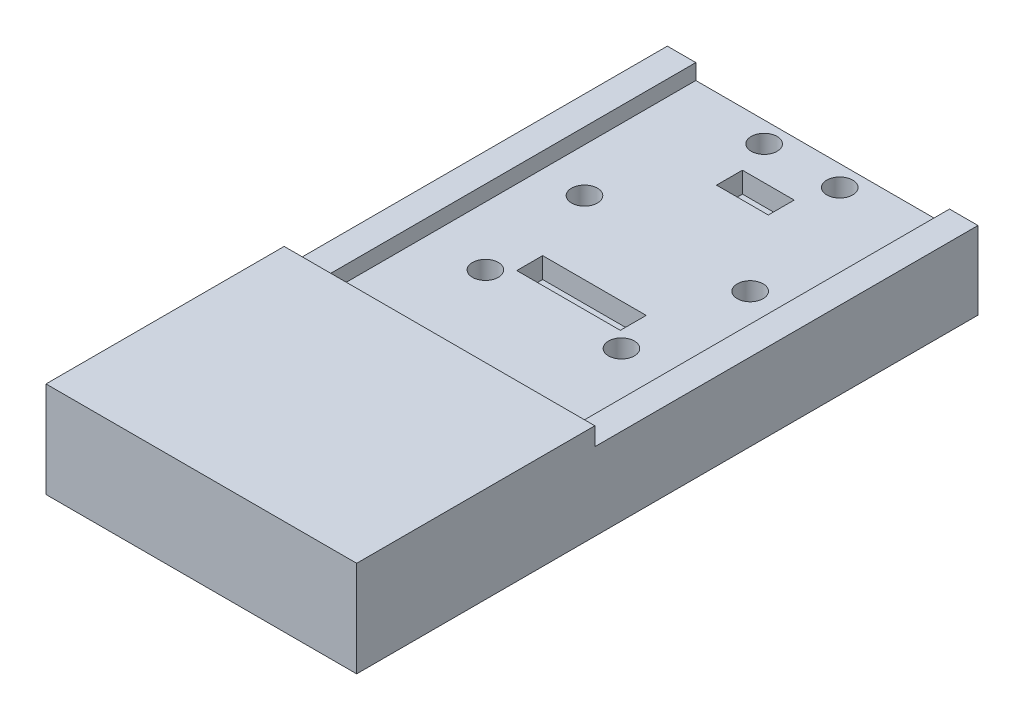
from build123d import *

# Parameters (mm, degrees)
SKETCH1_W           = 30
SKETCH1_H           = 60
SKETCH1_R           = 1.25
BOSS_EXTRUDE1_DEPTH = 6
SKETCH2_R           = 2.25
CUT_EXTRUDE1_DEPTH  = 2
SKETCH3_W           = 2.75
SKETCH3_H           = 60
BOSS_EXTRUDE2_DEPTH = 1.5
SKETCH4_R           = 1.25
SKETCH4_W           = 5
SKETCH4_H           = 2.5
SKETCH4_W_2         = 10
CUT_EXTRUDE2_DEPTH  = 2
SKETCH5_W           = 30
SKETCH5_H           = 23
BOSS_EXTRUDE3_DEPTH = 3.25


with BuildPart() as part:
    # Sketch1 → Boss-Extrude1 (new body)
    with BuildSketch(Plane(origin=(0, 0, 0), x_dir=(1, 0, 0), z_dir=(0, 1, 0))):
        Rectangle(SKETCH1_W, SKETCH1_H)
        with Locations(Location((-8, 15, 0), (0, 0, 270))):
            Circle(SKETCH1_R, mode=Mode.SUBTRACT)
        with Locations(Location((8, 15, 0), (0, 0, 270))):
            Circle(SKETCH1_R, mode=Mode.SUBTRACT)
    extrude(amount=-BOSS_EXTRUDE1_DEPTH)

    # Sketch2 → Cut-Extrude1 (cut)
    with BuildSketch(Plane(origin=(0, -6, 0), x_dir=(-1, 0, 0), z_dir=(0, -1, 0))):
        with Locations(Location((-8, 15, 0), (0, 0, 90))):
            Circle(SKETCH2_R)
        with Locations(Location((8, 15, 0), (0, 0, 90))):
            Circle(SKETCH2_R)
    extrude(amount=-CUT_EXTRUDE1_DEPTH, mode=Mode.SUBTRACT)

    # Sketch3 → Boss-Extrude2 (add)
    with BuildSketch(Plane(origin=(0, 0, 0), x_dir=(1, 0, 0), z_dir=(0, 1, 0))):
        with Locations((-13.625, 0)):
            Rectangle(SKETCH3_W, SKETCH3_H)
        with Locations((13.625, 0)):
            Rectangle(SKETCH3_W, SKETCH3_H)
    extrude(amount=BOSS_EXTRUDE2_DEPTH)

    # Sketch4 → Cut-Extrude2 (cut)
    with BuildSketch(Plane(origin=(0, 0, 0), x_dir=(1, 0, 0), z_dir=(0, 1, 0))):
        with Locations(Location((-3.65, 28, 0), (0, 0, 270))):
            Circle(SKETCH4_R)
        with Locations(Location((3.65, 28, 0), (0, 0, 270))):
            Circle(SKETCH4_R)
        with Locations(Location((-6.57, 4, 0), (0, 0, 270))):
            Circle(SKETCH4_R)
        with Locations(Location((6.57, 4, 0), (0, 0, 270))):
            Circle(SKETCH4_R)
        with Locations((0, 23.5)):
            Rectangle(SKETCH4_W, SKETCH4_H)
        with Locations((0, 6.71)):
            Rectangle(SKETCH4_W_2, SKETCH4_H)
    extrude(amount=-CUT_EXTRUDE2_DEPTH, mode=Mode.SUBTRACT)

    # Sketch5 → Boss-Extrude3 (add)
    with BuildSketch(Plane(origin=(0, 0, 0), x_dir=(1, 0, 0), z_dir=(0, 1, 0))):
        with Locations((0, -18.5)):
            Rectangle(SKETCH5_W, SKETCH5_H)
    extrude(amount=BOSS_EXTRUDE3_DEPTH)


solid = part.part
